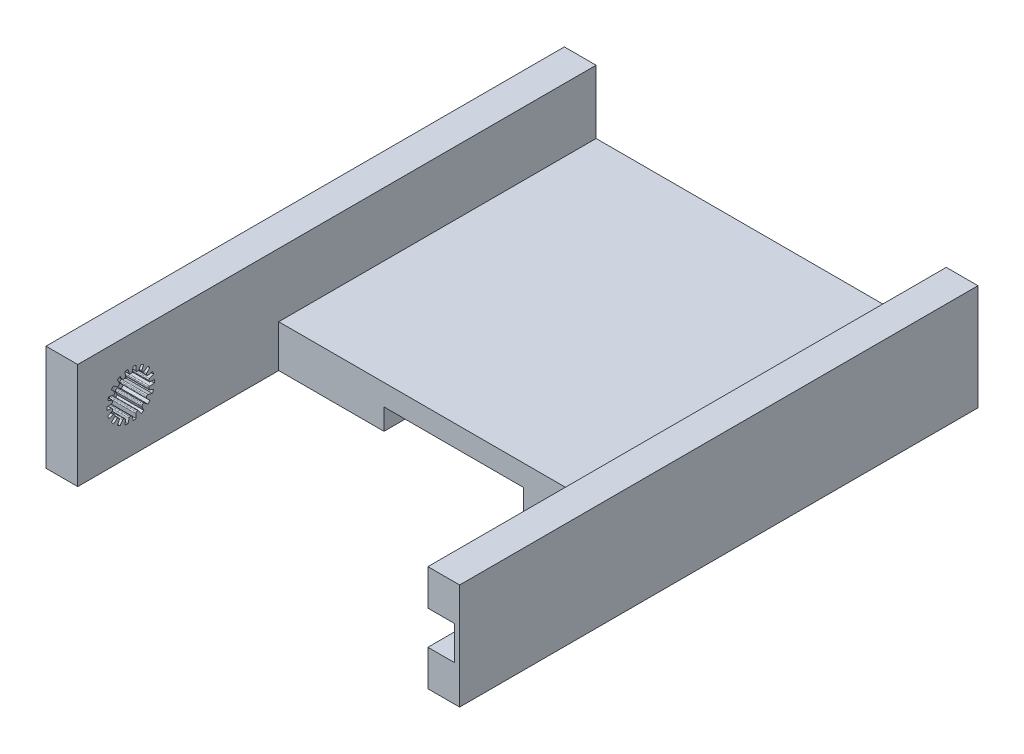
from build123d import *

# Parameters (mm, degrees)
SKETCH1_W             = 3
SKETCH1_H             = 49
BOSS_EXTRUDE1_DEPTH   = 10
BOSS_EXTRUDE1_2_DEPTH = 10
BOSS_EXTRUDE2_START   = -10
SKETCH2_W             = 33.1
SKETCH2_H             = 30
BOSS_EXTRUDE2_DEPTH   = 4
CUT_EXTRUDE1_START    = -10
SKETCH3_W             = 13.2
SKETCH3_H             = 30
CUT_EXTRUDE1_DEPTH    = 2
CUT_EXTRUDE2_START    = -3
CUT_EXTRUDE2_DEPTH    = 2.5
CUT_EXTRUDE3_START    = -36.1
SKETCH6_R             = 1.6
CUT_EXTRUDE3_DEPTH    = 2.5
CUT_EXTRUDE4_START    = -3.4
CUT_EXTRUDE4_DEPTH    = 3.2


with BuildPart() as part:
    # Sketch1 → Boss-Extrude1 (new body)
    with BuildSketch(Plane(origin=(0, 0, 0), x_dir=(1, 0, 0), z_dir=(0, 1, 0))):
        with Locations((-18.05, 24.5)):
            Rectangle(SKETCH1_W, SKETCH1_H)
    extrude(amount=BOSS_EXTRUDE1_DEPTH)



with BuildPart() as body_2:
    # Sketch1 → Boss-Extrude1 2 (new body)
    with BuildSketch(Plane(origin=(0, 0, 0), x_dir=(1, 0, 0), z_dir=(0, 1, 0))):
        with Locations((18.05, 24.5)):
            Rectangle(SKETCH1_W, SKETCH1_H)
    extrude(amount=BOSS_EXTRUDE1_2_DEPTH)


with BuildPart() as part_1:
    add(part.part)

    add(body_2.part)  # Boss-Extrude2 merges body 2
    # Sketch2 → Boss-Extrude2 (add)
    with BuildSketch(Plane(origin=(0, 10, 0), x_dir=(1, 0, 0), z_dir=(0, 1, 0)).offset(BOSS_EXTRUDE2_START)):
        with Locations((0, 34)):
            Rectangle(SKETCH2_W, SKETCH2_H)
    extrude(amount=BOSS_EXTRUDE2_DEPTH)

    # Sketch3 → Cut-Extrude1 (cut)
    with BuildSketch(Plane(origin=(0, 10, 0), x_dir=(1, 0, 0), z_dir=(0, 1, 0)).offset(CUT_EXTRUDE1_START)):
        with Locations((0, 34)):
            Rectangle(SKETCH3_W, SKETCH3_H)
    extrude(amount=CUT_EXTRUDE1_DEPTH, mode=Mode.SUBTRACT)

    # Sketch5 → Cut-Extrude2 (cut)
    with BuildSketch(Plane.ZY.offset(19.55).offset(CUT_EXTRUDE2_START)):
        with BuildLine():
            Line((-4.75, 7.236067977), (-4.854831539, 6.824677172))
            ThreePointArc((-4.854831539, 6.824677172), (-4.891407754, 6.769616655), (-4.954343768, 6.74940433))
            ThreePointArc((-4.954343768, 6.74940433), (-5, 6.75), (-5.045656232, 6.74940433))
            ThreePointArc((-5.045656232, 6.74940433), (-5.108592246, 6.769616655), (-5.145168461, 6.824677172))
            Line((-5.145168461, 6.824677172), (-5.25, 7.236067977))
            ThreePointArc((-5.25, 7.236067977), (-5.3907084, 7.215817444), (-5.529857135, 7.186721614))
            Line((-5.529857135, 7.186721614), (-5.487662617, 6.764286212))
            ThreePointArc((-5.487662617, 6.764286212), (-5.503201209, 6.700036448), (-5.555428696, 6.65951769))
            ThreePointArc((-5.555428696, 6.65951769), (-5.598535251, 6.644462086), (-5.641234343, 6.628286988))
            ThreePointArc((-5.641234343, 6.628286988), (-5.707287874, 6.625754976), (-5.760490079, 6.664985136))
            Line((-5.760490079, 6.664985136), (-5.999703445, 7.015711542))
            ThreePointArc((-5.999703445, 7.015711542), (-6.125, 6.948557159), (-6.24580568, 6.873624351))
            Line((-6.24580568, 6.873624351), (-6.061674385, 6.491096296))
            ThreePointArc((-6.061674385, 6.491096296), (-6.054301173, 6.425406755), (-6.089520725, 6.369468725))
            ThreePointArc((-6.089520725, 6.369468725), (-6.124878317, 6.340577775), (-6.15947013, 6.310774205))
            ThreePointArc((-6.15947013, 6.310774205), (-6.220674146, 6.285803254), (-6.28408537, 6.30447132))
            Line((-6.28408537, 6.30447132), (-6.628827901, 6.552230546))
            ThreePointArc((-6.628827901, 6.552230546), (-6.723599997, 6.446272122), (-6.811491673, 6.33454034))
            Line((-6.811491673, 6.33454034), (-6.507632554, 6.038058161))
            ThreePointArc((-6.507632554, 6.038058161), (-6.478236855, 5.978851971), (-6.492200475, 5.914241621))
            ThreePointArc((-6.492200475, 5.914241621), (-6.515544457, 5.875), (-6.537856707, 5.835162708))
            ThreePointArc((-6.537856707, 5.835162708), (-6.586829101, 5.790764683), (-6.652801015, 5.786619011))
            Line((-6.652801015, 5.786619011), (-7.061491673, 5.901527638))
            ThreePointArc((-7.061491673, 5.901527638), (-7.114308397, 5.769545322), (-7.158685036, 5.634491068))
            Line((-7.158685036, 5.634491068), (-6.771747987, 5.459814891))
            ThreePointArc((-6.771747987, 5.459814891), (-6.723875356, 5.414233193), (-6.714898826, 5.348743485))
            ThreePointArc((-6.714898826, 5.348743485), (-6.723413568, 5.303884311), (-6.730755068, 5.258818263))
            ThreePointArc((-6.730755068, 5.258818263), (-6.761589047, 5.200348221), (-6.822164464, 5.17388884))
            Line((-6.822164464, 5.17388884), (-7.245509125, 5.142087191))
            ThreePointArc((-7.245509125, 5.142087191), (-7.25, 5), (-7.245509125, 4.857912809))
            Line((-7.245509125, 4.857912809), (-6.822164464, 4.82611116))
            ThreePointArc((-6.822164464, 4.82611116), (-6.761589047, 4.799651779), (-6.730755068, 4.741181737))
            ThreePointArc((-6.730755068, 4.741181737), (-6.723413568, 4.696115689), (-6.714898826, 4.651256515))
            ThreePointArc((-6.714898826, 4.651256515), (-6.723875356, 4.585766807), (-6.771747987, 4.540185109))
            Line((-6.771747987, 4.540185109), (-7.158685036, 4.365508932))
            ThreePointArc((-7.158685036, 4.365508932), (-7.114308397, 4.230454678), (-7.061491673, 4.098472362))
            Line((-7.061491673, 4.098472362), (-6.652801015, 4.213380989))
            ThreePointArc((-6.652801015, 4.213380989), (-6.586829101, 4.209235317), (-6.537856707, 4.164837292))
            ThreePointArc((-6.537856707, 4.164837292), (-6.515544457, 4.125), (-6.492200475, 4.085758379))
            ThreePointArc((-6.492200475, 4.085758379), (-6.478236855, 4.021148029), (-6.507632554, 3.961941839))
            Line((-6.507632554, 3.961941839), (-6.811491673, 3.66545966))
            ThreePointArc((-6.811491673, 3.66545966), (-6.723599997, 3.553727878), (-6.628827901, 3.447769454))
            Line((-6.628827901, 3.447769454), (-6.28408537, 3.69552868))
            ThreePointArc((-6.28408537, 3.69552868), (-6.220674146, 3.714196746), (-6.15947013, 3.689225795))
            ThreePointArc((-6.15947013, 3.689225795), (-6.124878317, 3.659422225), (-6.089520725, 3.630531275))
            ThreePointArc((-6.089520725, 3.630531275), (-6.054301173, 3.574593245), (-6.061674385, 3.508903704))
            Line((-6.061674385, 3.508903704), (-6.24580568, 3.126375649))
            ThreePointArc((-6.24580568, 3.126375649), (-6.125, 3.051442841), (-5.999703445, 2.984288458))
            Line((-5.999703445, 2.984288458), (-5.760490079, 3.335014864))
            ThreePointArc((-5.760490079, 3.335014864), (-5.707287874, 3.374245024), (-5.641234343, 3.371713012))
            ThreePointArc((-5.641234343, 3.371713012), (-5.598535251, 3.355537914), (-5.555428696, 3.34048231))
            ThreePointArc((-5.555428696, 3.34048231), (-5.503201209, 3.299963552), (-5.487662617, 3.235713788))
            Line((-5.487662617, 3.235713788), (-5.529857135, 2.813278386))
            ThreePointArc((-5.529857135, 2.813278386), (-5.3907084, 2.784182556), (-5.25, 2.763932023))
            Line((-5.25, 2.763932023), (-5.145168461, 3.175322828))
            ThreePointArc((-5.145168461, 3.175322828), (-5.108592246, 3.230383345), (-5.045656232, 3.25059567))
            ThreePointArc((-5.045656232, 3.25059567), (-5, 3.25), (-4.954343768, 3.25059567))
            ThreePointArc((-4.954343768, 3.25059567), (-4.891407754, 3.230383345), (-4.854831539, 3.175322828))
            Line((-4.854831539, 3.175322828), (-4.75, 2.763932023))
            ThreePointArc((-4.75, 2.763932023), (-4.6092916, 2.784182556), (-4.470142865, 2.813278386))
            Line((-4.470142865, 2.813278386), (-4.512337383, 3.235713788))
            ThreePointArc((-4.512337383, 3.235713788), (-4.496798791, 3.299963552), (-4.444571304, 3.34048231))
            ThreePointArc((-4.444571304, 3.34048231), (-4.401464749, 3.355537914), (-4.358765657, 3.371713012))
            ThreePointArc((-4.358765657, 3.371713012), (-4.292712126, 3.374245024), (-4.239509921, 3.335014864))
            Line((-4.239509921, 3.335014864), (-4.000296555, 2.984288458))
            ThreePointArc((-4.000296555, 2.984288458), (-3.875, 3.051442841), (-3.75419432, 3.126375649))
            Line((-3.75419432, 3.126375649), (-3.938325615, 3.508903704))
            ThreePointArc((-3.938325615, 3.508903704), (-3.945698827, 3.574593245), (-3.910479275, 3.630531275))
            ThreePointArc((-3.910479275, 3.630531275), (-3.875121683, 3.659422225), (-3.84052987, 3.689225795))
            ThreePointArc((-3.84052987, 3.689225795), (-3.779325854, 3.714196746), (-3.71591463, 3.69552868))
            Line((-3.71591463, 3.69552868), (-3.371172099, 3.447769454))
            ThreePointArc((-3.371172099, 3.447769454), (-3.276400003, 3.553727878), (-3.188508327, 3.66545966))
            Line((-3.188508327, 3.66545966), (-3.492367446, 3.961941839))
            ThreePointArc((-3.492367446, 3.961941839), (-3.521763145, 4.021148029), (-3.507799525, 4.085758379))
            ThreePointArc((-3.507799525, 4.085758379), (-3.484455543, 4.125), (-3.462143293, 4.164837292))
            ThreePointArc((-3.462143293, 4.164837292), (-3.413170899, 4.209235317), (-3.347198985, 4.213380989))
            Line((-3.347198985, 4.213380989), (-2.938508327, 4.098472362))
            ThreePointArc((-2.938508327, 4.098472362), (-2.885691603, 4.230454678), (-2.841314964, 4.365508932))
            Line((-2.841314964, 4.365508932), (-3.228252013, 4.540185109))
            ThreePointArc((-3.228252013, 4.540185109), (-3.276124644, 4.585766807), (-3.285101174, 4.651256515))
            ThreePointArc((-3.285101174, 4.651256515), (-3.276586432, 4.696115689), (-3.269244932, 4.741181737))
            ThreePointArc((-3.269244932, 4.741181737), (-3.238410953, 4.799651779), (-3.177835536, 4.82611116))
            Line((-3.177835536, 4.82611116), (-2.754490875, 4.857912809))
            ThreePointArc((-2.754490875, 4.857912809), (-2.75, 5), (-2.754490875, 5.142087191))
            Line((-2.754490875, 5.142087191), (-3.177835536, 5.17388884))
            ThreePointArc((-3.177835536, 5.17388884), (-3.238410953, 5.200348221), (-3.269244932, 5.258818263))
            ThreePointArc((-3.269244932, 5.258818263), (-3.276586432, 5.303884311), (-3.285101174, 5.348743485))
            ThreePointArc((-3.285101174, 5.348743485), (-3.276124644, 5.414233193), (-3.228252013, 5.459814891))
            Line((-3.228252013, 5.459814891), (-2.841314964, 5.634491068))
            ThreePointArc((-2.841314964, 5.634491068), (-2.885691603, 5.769545322), (-2.938508327, 5.901527638))
            Line((-2.938508327, 5.901527638), (-3.347198985, 5.786619011))
            ThreePointArc((-3.347198985, 5.786619011), (-3.413170899, 5.790764683), (-3.462143293, 5.835162708))
            ThreePointArc((-3.462143293, 5.835162708), (-3.484455543, 5.875), (-3.507799525, 5.914241621))
            ThreePointArc((-3.507799525, 5.914241621), (-3.521763145, 5.978851971), (-3.492367446, 6.038058161))
            Line((-3.492367446, 6.038058161), (-3.188508327, 6.33454034))
            ThreePointArc((-3.188508327, 6.33454034), (-3.276400003, 6.446272122), (-3.371172099, 6.552230546))
            Line((-3.371172099, 6.552230546), (-3.71591463, 6.30447132))
            ThreePointArc((-3.71591463, 6.30447132), (-3.779325854, 6.285803254), (-3.84052987, 6.310774205))
            ThreePointArc((-3.84052987, 6.310774205), (-3.875121683, 6.340577775), (-3.910479275, 6.369468725))
            ThreePointArc((-3.910479275, 6.369468725), (-3.945698827, 6.425406755), (-3.938325615, 6.491096296))
            Line((-3.938325615, 6.491096296), (-3.75419432, 6.873624351))
            ThreePointArc((-3.75419432, 6.873624351), (-3.875, 6.948557159), (-4.000296555, 7.015711542))
            Line((-4.000296555, 7.015711542), (-4.239509921, 6.664985136))
            ThreePointArc((-4.239509921, 6.664985136), (-4.292712126, 6.625754976), (-4.358765657, 6.628286988))
            ThreePointArc((-4.358765657, 6.628286988), (-4.401464749, 6.644462086), (-4.444571304, 6.65951769))
            ThreePointArc((-4.444571304, 6.65951769), (-4.496798791, 6.700036448), (-4.512337383, 6.764286212))
            Line((-4.512337383, 6.764286212), (-4.470142865, 7.186721614))
            ThreePointArc((-4.470142865, 7.186721614), (-4.6092916, 7.215817444), (-4.75, 7.236067977))
        make_face()
    extrude(amount=CUT_EXTRUDE2_DEPTH, mode=Mode.SUBTRACT)

    # Sketch6 → Cut-Extrude3 (cut)
    with BuildSketch(Plane.ZY.offset(19.55).offset(CUT_EXTRUDE3_START)):
        with Locations(Location((-5, 5, 0), (0, 0, 180))):
            Circle(SKETCH6_R)
    extrude(amount=-CUT_EXTRUDE3_DEPTH, mode=Mode.SUBTRACT)

    # Sketch9 → Cut-Extrude4 (cut)
    with BuildSketch(Plane(origin=(0, 10, 0), x_dir=(1, 0, 0), z_dir=(0, 1, 0)).offset(CUT_EXTRUDE4_START)):
        Polygon((16.55, 5), (17.55, 5), (19.05, 0), (16.55, 0), align=None)
    extrude(amount=-CUT_EXTRUDE4_DEPTH, mode=Mode.SUBTRACT)


solid = part_1.part
